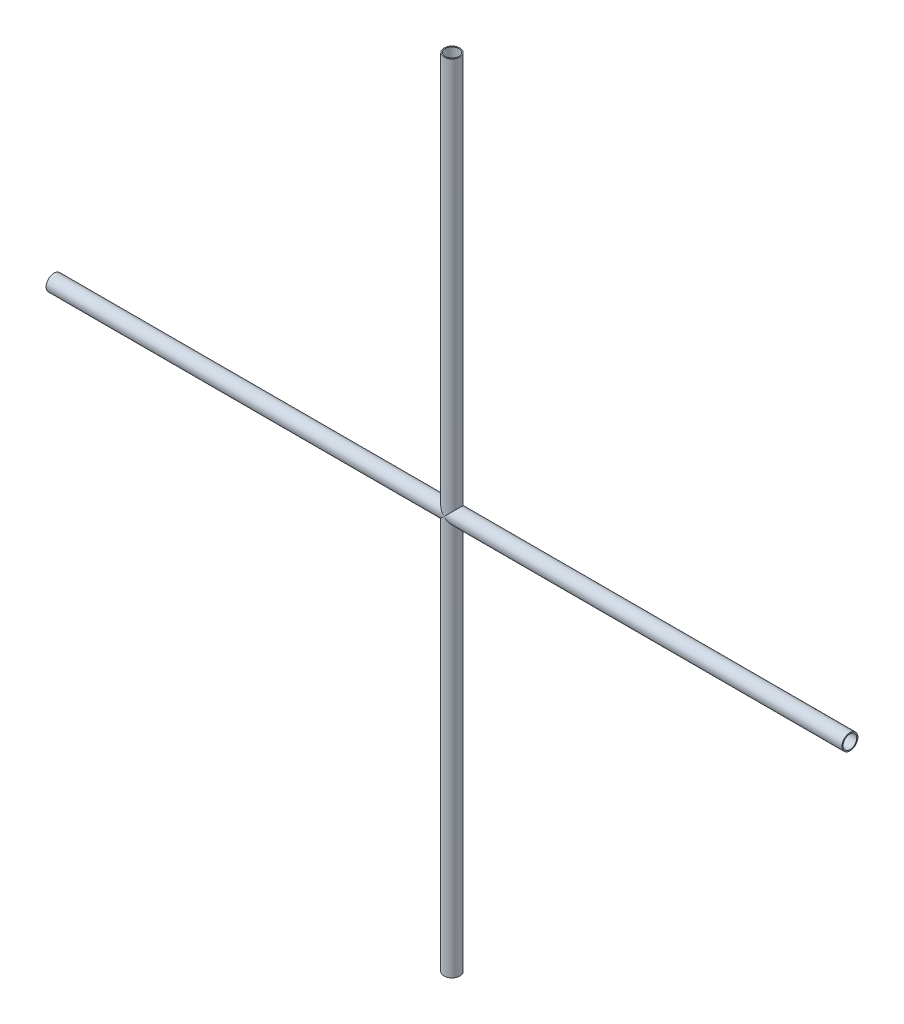
from build123d import *

# Parameters (mm, degrees)
SKETCH1_R           = 3
SKETCH1_R_2         = 2.575
BOSS_EXTRUDE1_DEPTH = 150
SKETCH2_R           = 3
SKETCH2_R_2         = 2.575
BOSS_EXTRUDE2_DEPTH = 150


with BuildPart() as part:
    # Sketch1 → Boss-Extrude1 (new, symmetric)
    with BuildSketch(Plane(origin=(0, 0, 0), x_dir=(1, 0, 0), z_dir=(0, 1, 0))):
        with Locations(Location((0, 0, 0), (0, 0, 270))):
            Circle(SKETCH1_R)
        with Locations(Location((0, 0, 0), (0, 0, 270))):
            Circle(SKETCH1_R_2, mode=Mode.SUBTRACT)
    extrude(amount=BOSS_EXTRUDE1_DEPTH, both=True)

    # Sketch2 → Boss-Extrude2 (add, symmetric)
    with BuildSketch(Plane(origin=(0, 0, 0), x_dir=(0, 0, -1), z_dir=(1, 0, 0))):
        Circle(SKETCH2_R)
        with Locations(Location((0, 0, 0), (0, 0, 180))):
            Circle(SKETCH2_R_2, mode=Mode.SUBTRACT)
    extrude(amount=BOSS_EXTRUDE2_DEPTH, both=True)


solid = part.part
